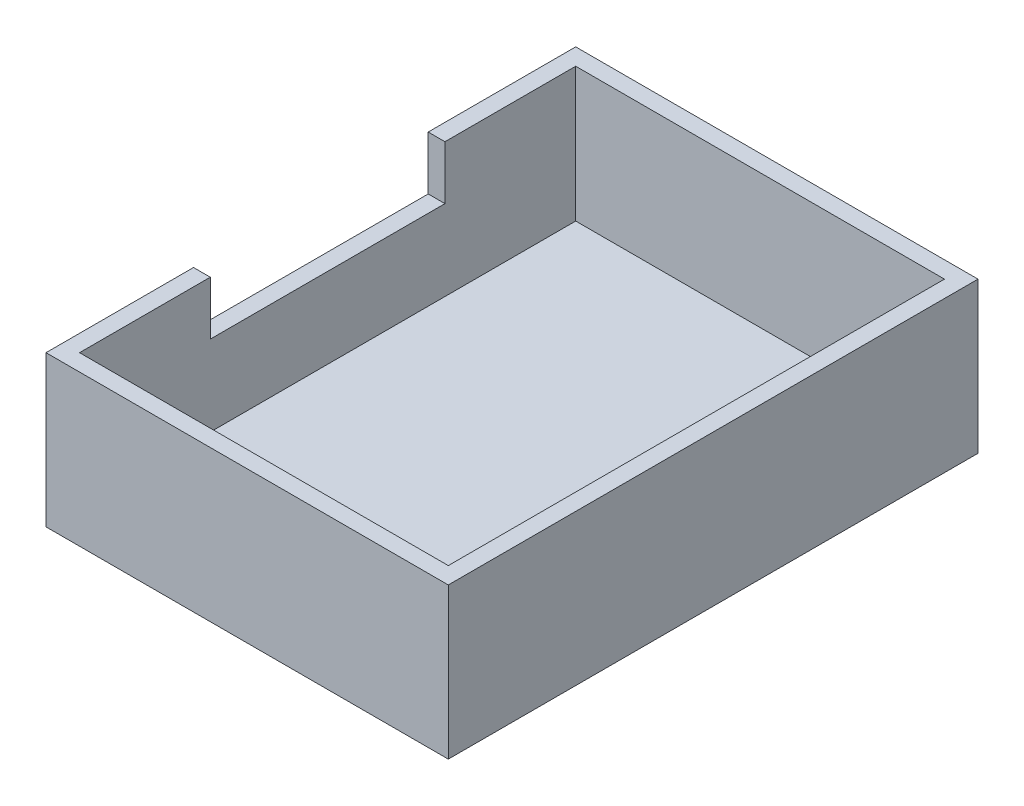
from build123d import *

# Parameters (mm, degrees)
SKETCH1_W           = 120
SKETCH1_H           = 158
SKETCH1_W_2         = 110
SKETCH1_H_2         = 148
BOSS_EXTRUDE1_DEPTH = 40
SKETCH2_W           = 120
SKETCH2_H           = 158
BOSS_EXTRUDE2_DEPTH = 5
SKETCH3_W           = 5
SKETCH3_H           = 70
CUT_EXTRUDE1_DEPTH  = 16


with BuildPart() as part:
    # Sketch1 → Boss-Extrude1 (new body)
    with BuildSketch(Plane(origin=(0, 0, 0), x_dir=(1, 0, 0), z_dir=(0, 1, 0))):
        Rectangle(SKETCH1_W, SKETCH1_H)
        Rectangle(SKETCH1_W_2, SKETCH1_H_2, mode=Mode.SUBTRACT)
    extrude(amount=BOSS_EXTRUDE1_DEPTH)

    # Sketch2 → Boss-Extrude2 (add)
    with BuildSketch(Plane.XZ):
        Rectangle(SKETCH2_W, SKETCH2_H)
    extrude(amount=BOSS_EXTRUDE2_DEPTH)

    # Sketch3 → Cut-Extrude1 (cut)
    with BuildSketch(Plane(origin=(0, 40, 0), x_dir=(1, 0, 0), z_dir=(0, 1, 0))):
        with Locations((-57.5, 0)):
            Rectangle(SKETCH3_W, SKETCH3_H)
    extrude(amount=-CUT_EXTRUDE1_DEPTH, mode=Mode.SUBTRACT)


solid = part.part
